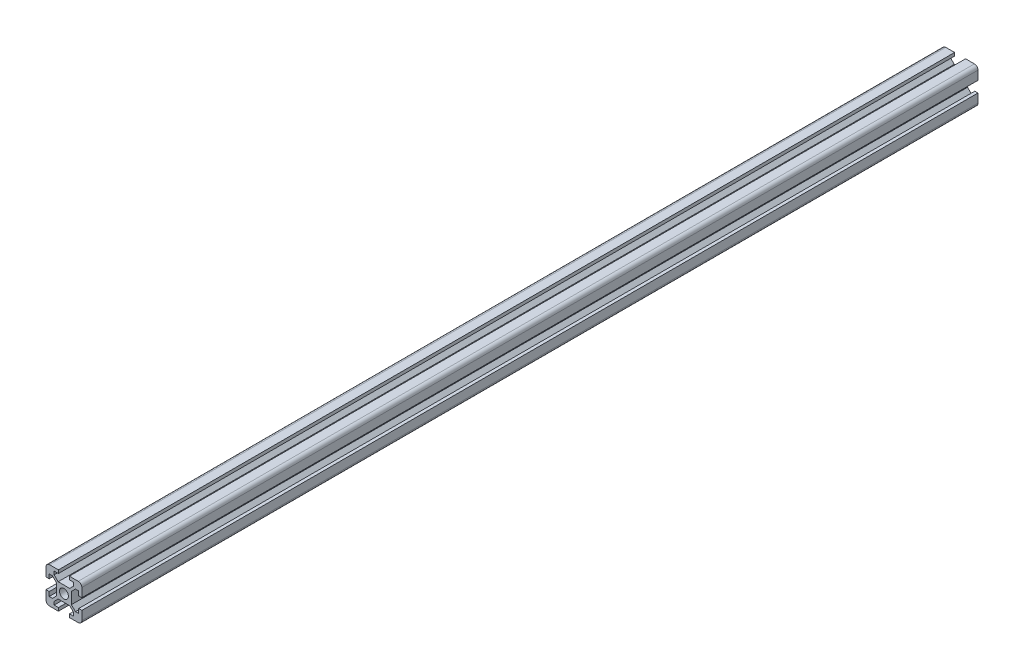
from build123d import *

# Parameters (mm, degrees)
SKETCH1_R           = 2.5
BOSS_EXTRUDE1_DEPTH = 500
FILLET1_R           = 2


with BuildPart() as part:
    # Sketch1 → Boss-Extrude1 (new body)
    with BuildSketch(Plane.XY):
        Polygon((-5.46, -6.42), (-3.215, -4.175), (3.215, -4.175), (5.46, -6.42), (5.46, -8.22), (3.06, -8.22), (3.06, -10), (10, -10), (10, -3.06), (8.22, -3.06), (8.22, -5.46), (6.42, -5.46), (4.175, -3.215), (4.175, 3.215), (6.42, 5.46), (8.22, 5.46), (8.22, 3.06), (10, 3.06), (10, 10), (3.06, 10), (3.06, 8.22), (5.46, 8.22), (5.46, 6.42), (3.215, 4.175), (-3.215, 4.175), (-5.46, 6.42), (-5.46, 8.22), (-3.06, 8.22), (-3.06, 10), (-10, 10), (-10, 3.06), (-8.22, 3.06), (-8.22, 5.46), (-6.42, 5.46), (-4.175, 3.215), (-4.175, -3.215), (-6.42, -5.46), (-8.22, -5.46), (-8.22, -3.06), (-10, -3.06), (-10, -10), (-3.06, -10), (-3.06, -8.22), (-5.46, -8.22), align=None)
        Circle(SKETCH1_R, mode=Mode.SUBTRACT)
    extrude(amount=BOSS_EXTRUDE1_DEPTH)

    # Fillet1
    fillet1_edges = [part.edges().sort_by_distance(p)[0] for p in [
        (10, -10, 250),
        (-10, -10, 250),
        (-10, 10, 250),
        (10, 10, 250),
    ]]
    fillet(fillet1_edges, radius=FILLET1_R)


solid = part.part
